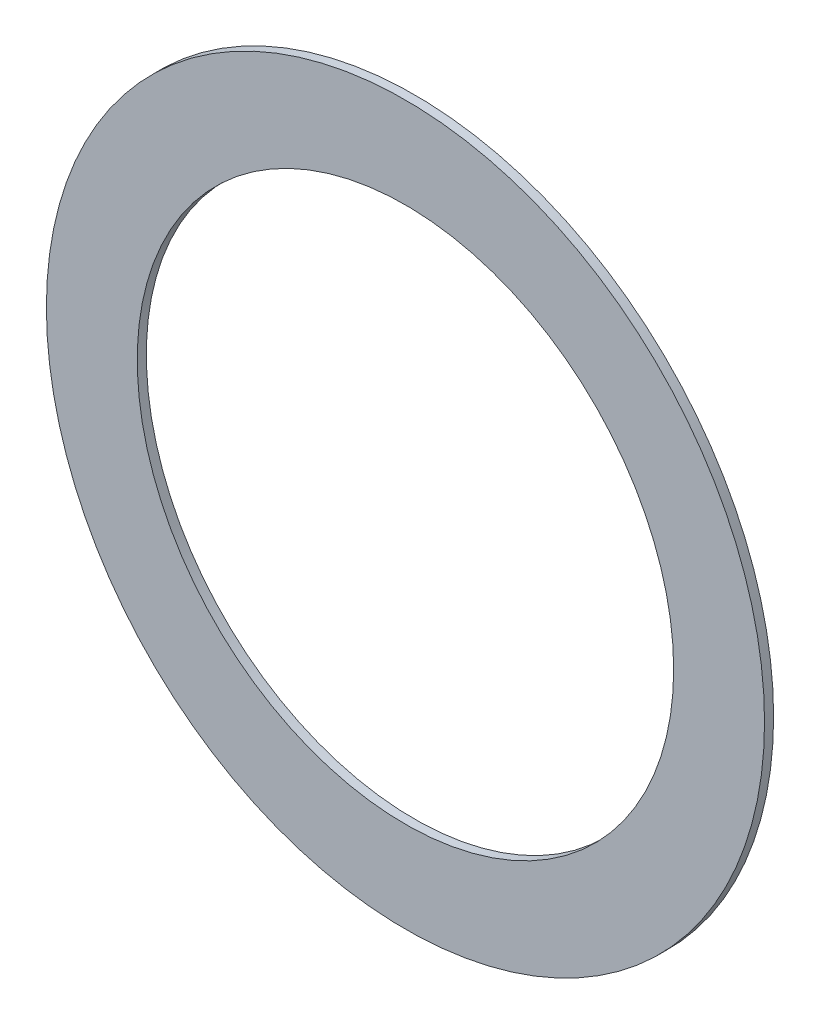
from build123d import *

# Parameters (mm, degrees)
SKETCH1_R           = 39.522
SKETCH1_R_2         = 29.522
BOSS_EXTRUDE2_DEPTH = 1


with BuildPart() as part:
    # Sketch1 → Boss-Extrude2 (new body)
    with BuildSketch(Plane(origin=(0, 0, 0), x_dir=(0.9999530758491465, 0.009687419668383268, 0), z_dir=(0, 0, 1))):
        with Locations(Location((-34.407011623, 7.301137511, 0), (0, 0, 359.444943057))):
            Circle(SKETCH1_R)
        with Locations(Location((-34.407011623, 7.301137511, 0), (0, 0, 359.444943057))):
            Circle(SKETCH1_R_2, mode=Mode.SUBTRACT)
    extrude(amount=BOSS_EXTRUDE2_DEPTH)


solid = part.part
